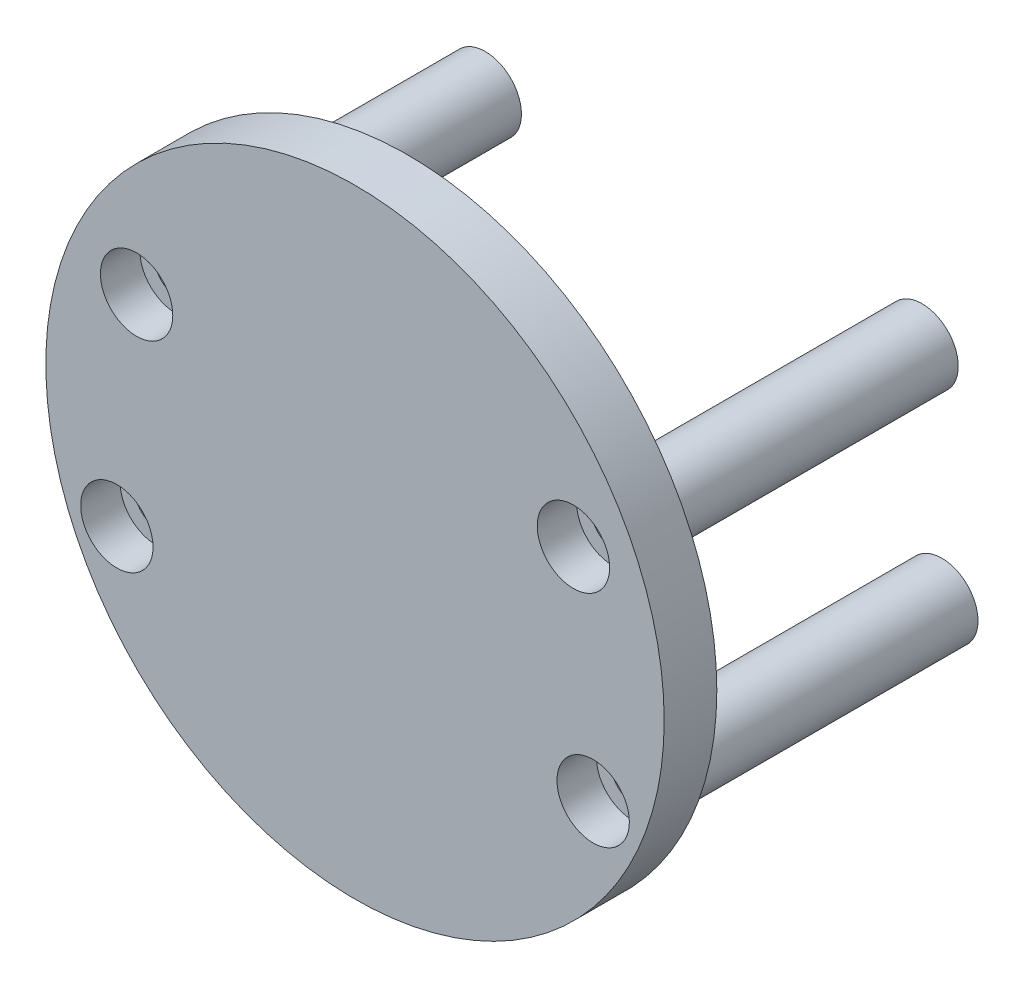
from build123d import *

# Parameters (mm, degrees)
EXTRUDE_1_DEPTH      = 3
EXTRUDE_1_DEPTH_BACK = 1
SKETCH_1_R           = 23.5
SKETCH_1_4_R         = 2.75
SKETCH_1_4_R_2       = 1.6
EXTRUDE_2_DEPTH      = 23.5
EXTRUDE_2_2_DEPTH    = 23.5
EXTRUDE_2_3_DEPTH    = 23.5
EXTRUDE_2_4_DEPTH    = 23.5


with BuildPart() as part:
    # ｽｹｯﾁ1 → ﾎﾞｽ - 押し出し1 (new, two sides: drawn at the far end of the back side and taken through both)
    with BuildSketch(Plane.XY.offset(-EXTRUDE_1_DEPTH_BACK)):
        Circle(SKETCH_1_R)
        with BuildLine():
            ThreePointArc((-15.35, -8), (-20.044543648, -9.944543648), (-18.1, -5.25))
            ThreePointArc((-18.1, -5.25), (-16.155456352, -6.055456352), (-15.35, -8))
        make_face(mode=Mode.SUBTRACT)
        with BuildLine():
            ThreePointArc((20.85, -8), (16.155456352, -9.944543648), (18.1, -5.25))
            ThreePointArc((18.1, -5.25), (20.044543648, -6.055456352), (20.85, -8))
        make_face(mode=Mode.SUBTRACT)
        with BuildLine():
            ThreePointArc((-13.85, 8), (-14.655456352, 6.055456352), (-16.6, 5.25))
            ThreePointArc((-16.6, 5.25), (-18.544543648, 9.944543648), (-13.85, 8))
        make_face(mode=Mode.SUBTRACT)
        with BuildLine():
            ThreePointArc((19.35, 8), (18.544543648, 6.055456352), (16.6, 5.25))
            ThreePointArc((16.6, 5.25), (14.655456352, 9.944543648), (19.35, 8))
        make_face(mode=Mode.SUBTRACT)
    extrude(amount=EXTRUDE_1_DEPTH + EXTRUDE_1_DEPTH_BACK)


with BuildPart() as body_2:
    # ｽｹｯﾁ1<4> → ﾎﾞｽ - 押し出し2 (new body)
    with BuildSketch(Plane.XY):
        with Locations((16.6, 8)):
            Circle(SKETCH_1_4_R)
        with Locations((16.6, 8)):
            Circle(SKETCH_1_4_R_2, mode=Mode.SUBTRACT)
    extrude(amount=-EXTRUDE_2_DEPTH)


with BuildPart() as body_3:
    # ｽｹｯﾁ1<4> → Extrude 2 2 (new body)
    with BuildSketch(Plane.XY):
        with Locations((18.1, -8)):
            Circle(SKETCH_1_4_R)
        with Locations((18.1, -8)):
            Circle(SKETCH_1_4_R_2, mode=Mode.SUBTRACT)
    extrude(amount=-EXTRUDE_2_2_DEPTH)


with BuildPart() as body_4:
    # ｽｹｯﾁ1<4> → Extrude 2 3 (new body)
    with BuildSketch(Plane.XY):
        with Locations((-16.6, 8)):
            Circle(SKETCH_1_4_R)
        with Locations((-16.6, 8)):
            Circle(SKETCH_1_4_R_2, mode=Mode.SUBTRACT)
    extrude(amount=-EXTRUDE_2_3_DEPTH)


with BuildPart() as body_5:
    # ｽｹｯﾁ1<4> → Extrude 2 4 (new body)
    with BuildSketch(Plane.XY):
        with Locations((-18.1, -8)):
            Circle(SKETCH_1_4_R)
        with Locations((-18.1, -8)):
            Circle(SKETCH_1_4_R_2, mode=Mode.SUBTRACT)
    extrude(amount=-EXTRUDE_2_4_DEPTH)


solid = Compound([part.part, body_2.part, body_3.part, body_4.part, body_5.part])
